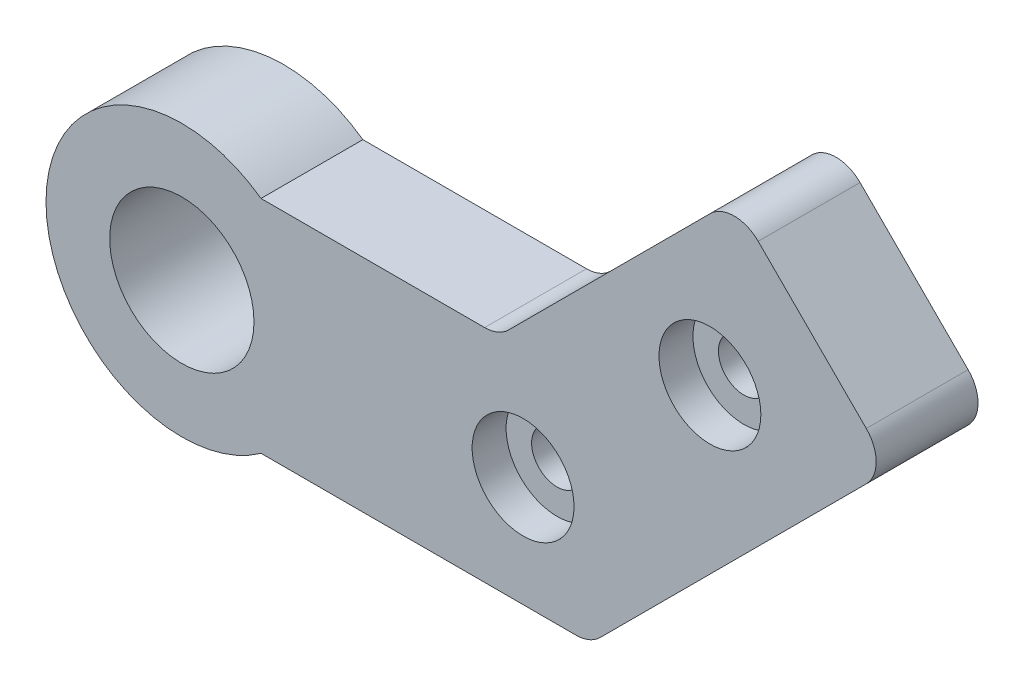
from build123d import *

# Parameters (mm, degrees)
BOSS_EXTRU_1_DEPTH      = 6
CONG_1_R                = 2
ESQUISSE2_R             = 4.25
ESQUISSE2_R_2           = 1.5
ENL_V_MAT_EXTRU_1_DEPTH = 36.335346375
ESQUISSE3_R             = 3
ENL_V_MAT_EXTRU_2_DEPTH = 2


with BuildPart() as part:
    # Esquisse1 → Boss.-Extru.1 (new body)
    with BuildSketch(Plane.XY):
        with BuildLine():
            Line((-16.712083242, 5.657318013), (-2.712083242, 5.657318013))
            Line((-2.712083242, 5.657318013), (11.157974444, 19.527375698))
            Line((11.157974444, 19.527375698), (20.350362599, 10.334987543))
            Line((20.350362599, 10.334987543), (2.672693069, -7.342681987))
            Line((2.672693069, -7.342681987), (-16.712083242, -7.342681987))
            ThreePointArc((-16.712083242, -7.342681987), (-29.375772768, -0.842681987), (-16.712083242, 5.657318013))
        make_face()
    extrude(amount=BOSS_EXTRU_1_DEPTH)

    # Congé1
    cong_1_edges = [part.edges().sort_by_distance(p)[0] for p in [
        (-2.712083242, 5.657318013, 3),
        (11.157974444, 19.527375698, 3),
        (20.350362599, 10.334987543, 3),
        (2.672693069, -7.342681987, 3),
    ]]
    fillet(cong_1_edges, radius=CONG_1_R)

    # Esquisse2 → Enlèv. mat.-Extru.1 (cut, through all)
    with BuildSketch(Plane.XY.offset(6)):
        with Locations((-21.375772768, -0.842681987)):
            Circle(ESQUISSE2_R)
        with Locations((-1.275772768, -0.842681987)):
            Circle(ESQUISSE2_R_2)
        with Locations((9.728897785, 9.350316885)):
            Circle(ESQUISSE2_R_2)
    extrude(amount=-ENL_V_MAT_EXTRU_1_DEPTH, mode=Mode.SUBTRACT)

    # Esquisse3 → Enlèv. mat.-Extru.2 (cut)
    with BuildSketch(Plane.XY.offset(6)):
        with Locations((-1.275772768, -0.842681987)):
            Circle(ESQUISSE3_R)
        with Locations((9.728897785, 9.350316885)):
            Circle(ESQUISSE3_R)
    extrude(amount=-ENL_V_MAT_EXTRU_2_DEPTH, mode=Mode.SUBTRACT)


solid = part.part
